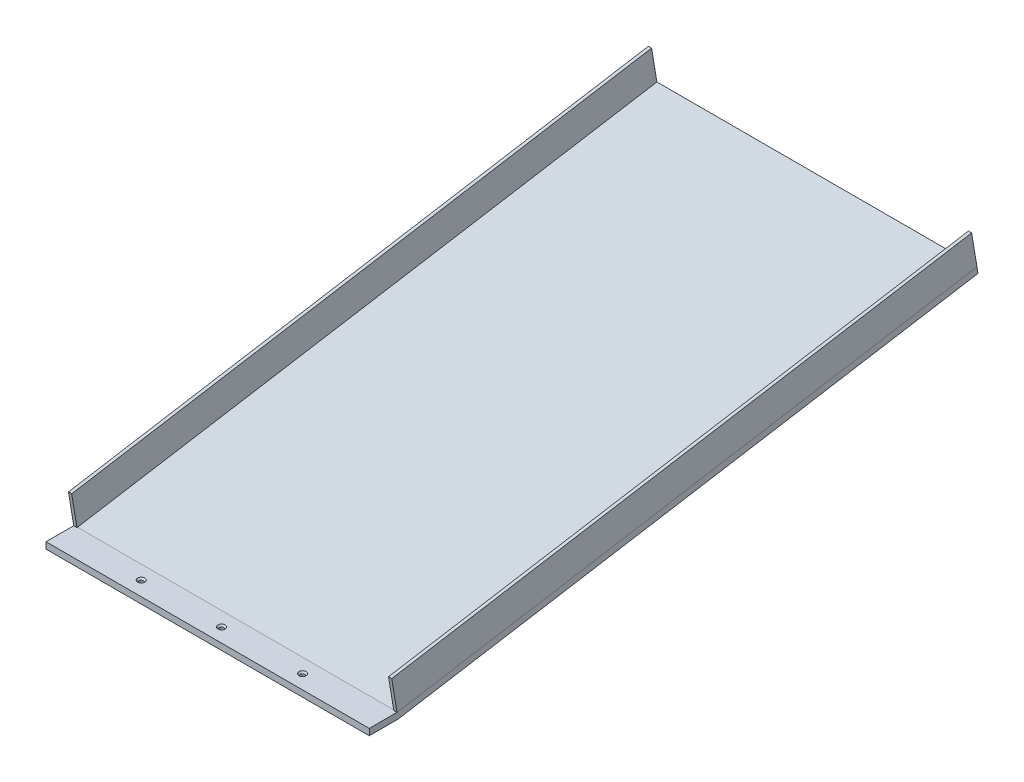
from build123d import *

# Parameters (mm, degrees)
SKETCH3_W                                     = 256.54
SKETCH3_H                                     = 466.513302601
BOSS_EXTRUDE1_DEPTH                           = 5.08
BOSS_EXTRUDE2_DEPTH                           = 2.54
BOSS_EXTRUDE3_DEPTH                           = 2.54
SKETCH7_W                                     = 256.54
SKETCH7_H                                     = 22.86
BOSS_EXTRUDE5_DEPTH                           = 5.08
CSK_FOR_4_FLAT_HEAD_MACHINE_SCREW1_AT_2_COUNT = 2
CSK_FOR_4_FLAT_HEAD_MACHINE_SCREW1_AT_2_PITCH = 64.13577202
CSK_FOR_4_FLAT_HEAD_MACHINE_SCREW1_AT_3_COUNT = 2
CSK_FOR_4_FLAT_HEAD_MACHINE_SCREW1_AT_3_PITCH = 128.362052605


with BuildPart() as part:
    # Sketch3 → Boss-Extrude1 (new body)
    with BuildSketch(Plane(origin=(0, 0, 0), x_dir=(1, 0, 0), z_dir=(0, 0.9865699379494779, 0.16333939370024467))):
        with Locations((0, 233.256651301)):
            Rectangle(SKETCH3_W, SKETCH3_H)
    extrude(amount=BOSS_EXTRUDE1_DEPTH)

    # Sketch5 → Boss-Extrude3 (add)
    with BuildSketch(Plane.ZY.offset(128.27)):
        Polygon((-459.41823588, 81.211775285), (-455.212937867, 106.611775285), (5.035062133, 30.411775285), (0.82976412, 5.011775285), align=None)
    extrude(amount=-BOSS_EXTRUDE3_DEPTH)

    # Sketch7 → Boss-Extrude5 (add)
    with BuildSketch(Plane(origin=(0, 0, 0), x_dir=(1, 0, 0), z_dir=(0, 1, 0))):
        with Locations((0, -11.43)):
            Rectangle(SKETCH7_W, SKETCH7_H)
    extrude(amount=BOSS_EXTRUDE5_DEPTH)

    # Sketch10 → CSK for #4 Flat Head Machine Screw1 (revolve, cut)
    with BuildSketch(Plane(origin=(-64.135, 5.08, 11.43), x_dir=(0, 0, 1), z_dir=(1, 0, 0))):
        Polygon((0, 0), (0, 5.08), (1.7272, 5.08), (1.7272, 1.300261411), (2.8575, 0), align=None)
    csk_for_4_flat_head_machine_screw1 = revolve(axis=Axis((-64.135, 11.43, 11.43), (0, -1, 0)), mode=Mode.SUBTRACT)

    # CSK for #4 Flat Head Machine Screw1 at 2: CSK for #4 Flat Head Machine Screw1 ×2
    with Locations(*[Vector(0.9999879627163539, 0, 0.004906569310242864) * (i * CSK_FOR_4_FLAT_HEAD_MACHINE_SCREW1_AT_2_PITCH) for i in range(1, CSK_FOR_4_FLAT_HEAD_MACHINE_SCREW1_AT_2_COUNT)]):
        add(csk_for_4_flat_head_machine_screw1, mode=Mode.SUBTRACT)

    # CSK for #4 Flat Head Machine Screw1 at 3: CSK for #4 Flat Head Machine Screw1 ×2
    with Locations(*[Vector(0.9999979218877366, 0, 0.0020386809972081535) * (i * CSK_FOR_4_FLAT_HEAD_MACHINE_SCREW1_AT_3_PITCH) for i in range(1, CSK_FOR_4_FLAT_HEAD_MACHINE_SCREW1_AT_3_COUNT)]):
        add(csk_for_4_flat_head_machine_screw1, mode=Mode.SUBTRACT)


with BuildPart() as body_2:
    # Sketch4 → Boss-Extrude2 (new body)
    with BuildSketch(Plane(origin=(128.27, 0, 0), x_dir=(0, 0, -1), z_dir=(1, 0, 0))):
        Polygon((-0.82976412, 5.011775285), (459.41823588, 81.211775285), (455.212937867, 106.611775285), (-5.035062133, 30.411775285), align=None)
    extrude(amount=-BOSS_EXTRUDE2_DEPTH)


solid = Compound([part.part, body_2.part])
